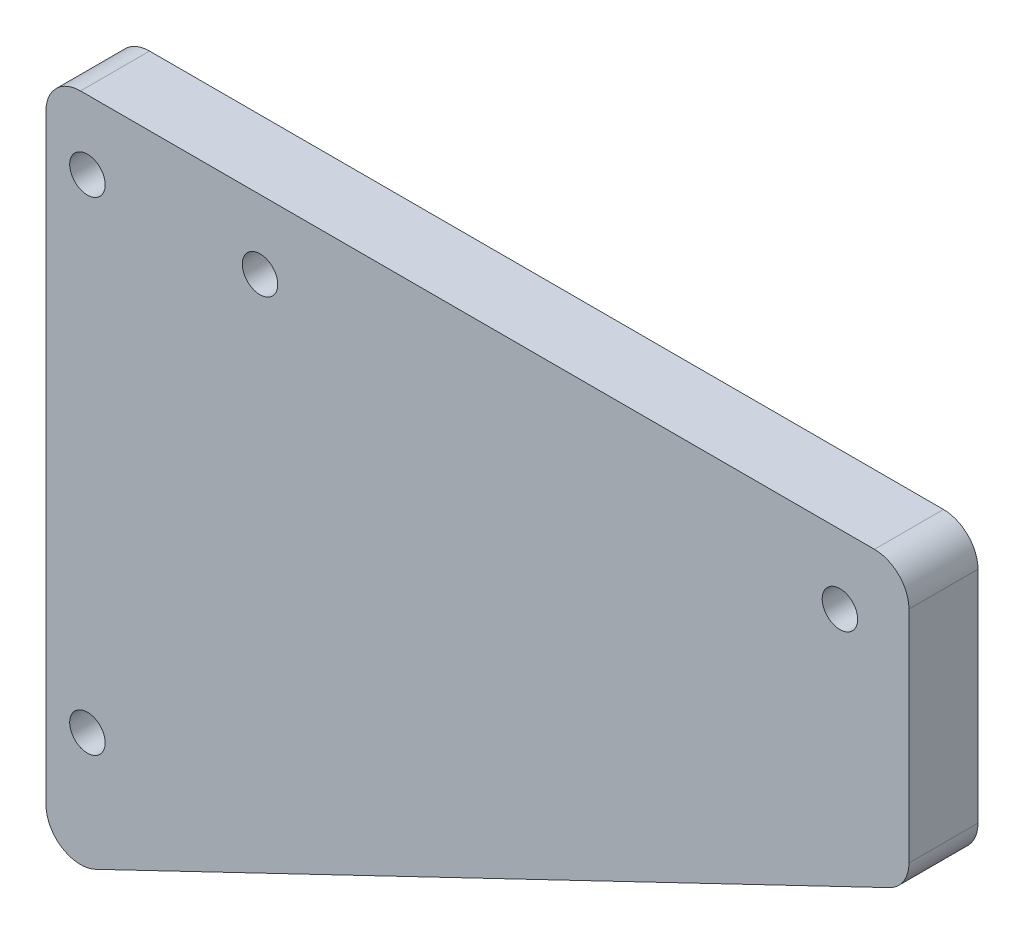
from build123d import *

# Parameters (mm, degrees)
BOSS_EXTRUDE1_DEPTH       = 6.35
F_4_CLEARANCE_HOLE1_D     = 3.2639
F_4_CLEARANCE_HOLE1_DEPTH = 12.7
F_4_CLEARANCE_HOLE1_TIP   = 0.980574487
FILLET1_R                 = 3.175


with BuildPart() as part:
    # Sketch1 → Boss-Extrude1 (new body)
    with BuildSketch(Plane.XY):
        Polygon((-38.1, -57.15), (41.275, -19.05), (41.275, 6.35), (-38.1, 6.35), align=None)
    extrude(amount=BOSS_EXTRUDE1_DEPTH)

    # #4 Clearance Hole1
    with Locations(Plane.XY.offset(6.35)):
        with Locations((-34.29, 0), (-18.415, 0), (34.925, 0), (-34.29, -44.45)):
            Hole(F_4_CLEARANCE_HOLE1_D / 2, depth=F_4_CLEARANCE_HOLE1_DEPTH)
            with Locations((0, 0, -(F_4_CLEARANCE_HOLE1_DEPTH + F_4_CLEARANCE_HOLE1_TIP / 2))):  # 118° drill point
                Cone(0, F_4_CLEARANCE_HOLE1_D / 2, F_4_CLEARANCE_HOLE1_TIP, mode=Mode.SUBTRACT)

    # Fillet1
    fillet1_edges = [part.edges().sort_by_distance(p)[0] for p in [
        (41.275, -19.05, 3.175),
        (-38.1, -57.15, 3.175),
        (-38.1, 6.35, 3.175),
        (41.275, 6.35, 3.175),
    ]]
    fillet(fillet1_edges, radius=FILLET1_R)


solid = part.part
